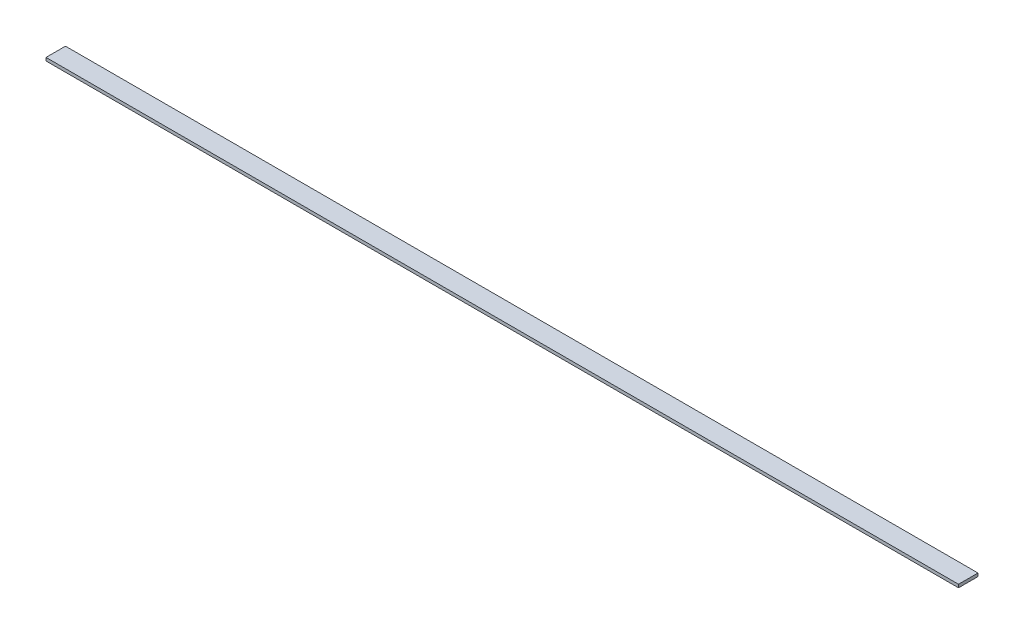
from build123d import *

# Parameters (mm, degrees)
BOSS_EXTRUDE1_DEPTH      = 505
BOSS_EXTRUDE1_DEPTH_BACK = 666
SKETCH3_W                = 25
SKETCH3_H                = 4


with BuildPart() as part:
    # Sketch3 → Boss-Extrude1 (new, two sides: drawn at the far end of the back side and taken through both)
    with BuildSketch(Plane(origin=(0, 0, 0), x_dir=(0, 0, -1), z_dir=(1, 0, 0)).offset(-BOSS_EXTRUDE1_DEPTH_BACK)):
        Rectangle(SKETCH3_W, SKETCH3_H)
    extrude(amount=BOSS_EXTRUDE1_DEPTH + BOSS_EXTRUDE1_DEPTH_BACK)


solid = part.part
